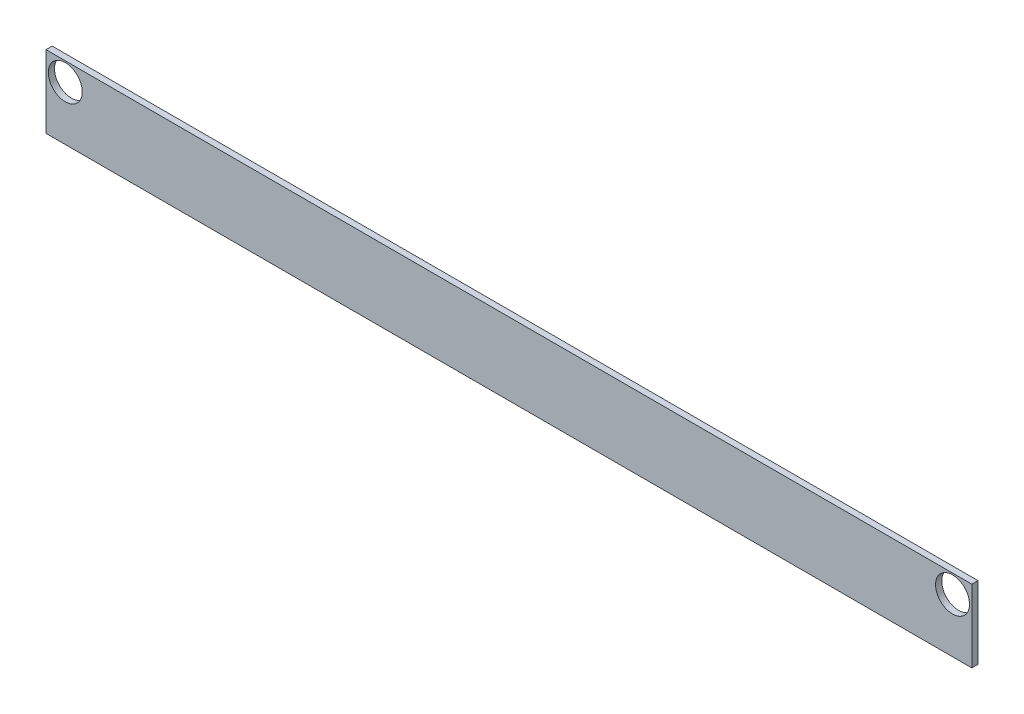
from build123d import *

# Parameters (mm, degrees)
CROQUIS1_W              = 600
CROQUIS1_H              = 47
SALIENTE_EXTRUIR1_DEPTH = 4
CROQUIS2_R              = 11
CORTAR_EXTRUIR1_DEPTH   = 4


with BuildPart() as part:
    # Croquis1 → Saliente-Extruir1 (new body)
    with BuildSketch(Plane.XY):
        with Locations((0, -11.5)):
            Rectangle(CROQUIS1_W, CROQUIS1_H)
    extrude(amount=SALIENTE_EXTRUIR1_DEPTH)

    # Croquis2 → Cortar-Extruir1 (cut)
    with BuildSketch(Plane.XY.offset(4)):
        with Locations((287.5, 0)):
            Circle(CROQUIS2_R)
        with Locations(Location((-287.5, 0, 0), (0, 0, 180))):
            Circle(CROQUIS2_R)
    extrude(amount=-CORTAR_EXTRUIR1_DEPTH, mode=Mode.SUBTRACT)


solid = part.part
